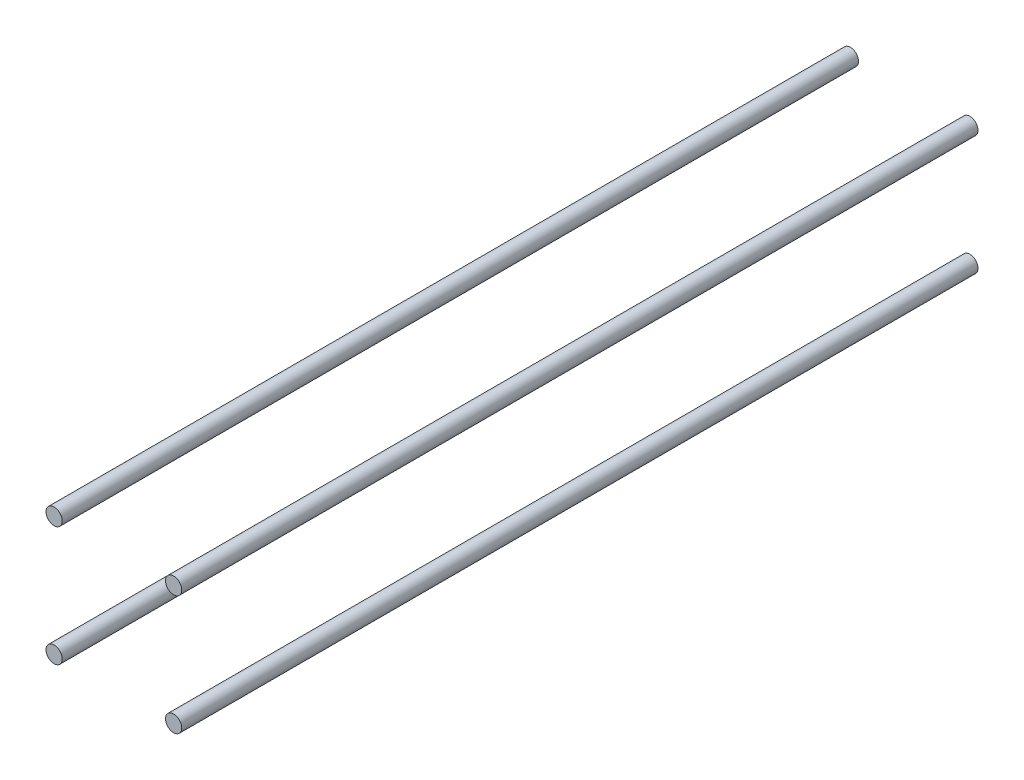
from build123d import *

# Parameters (mm, degrees)
SKETCH_3_R        = 2.5
EXTRUDE_2_DEPTH   = 245
EXTRUDE_2_2_DEPTH = 245
EXTRUDE_2_3_DEPTH = 245
EXTRUDE_2_4_DEPTH = 245


with BuildPart() as part:
    # Эскиз3 → Вытянуть2 (new body)
    with BuildSketch(Plane.XY):
        with Locations((18.383354246, 18.383354246)):
            Circle(SKETCH_3_R)
    extrude(amount=EXTRUDE_2_DEPTH)


with BuildPart() as body_2:
    # Эскиз3 → Extrude 2 2 (new body)
    with BuildSketch(Plane.XY):
        with Locations((18.383354246, -18.383354246)):
            Circle(SKETCH_3_R)
    extrude(amount=EXTRUDE_2_2_DEPTH)


with BuildPart() as body_3:
    # Эскиз3 → Extrude 2 3 (new body)
    with BuildSketch(Plane.XY):
        with Locations((-18.383354246, -18.383354246)):
            Circle(SKETCH_3_R)
    extrude(amount=EXTRUDE_2_3_DEPTH)


with BuildPart() as body_4:
    # Эскиз3 → Extrude 2 4 (new body)
    with BuildSketch(Plane.XY):
        with Locations((-18.383354246, 18.383354246)):
            Circle(SKETCH_3_R)
    extrude(amount=EXTRUDE_2_4_DEPTH)


solid = Compound([part.part, body_2.part, body_3.part, body_4.part])
